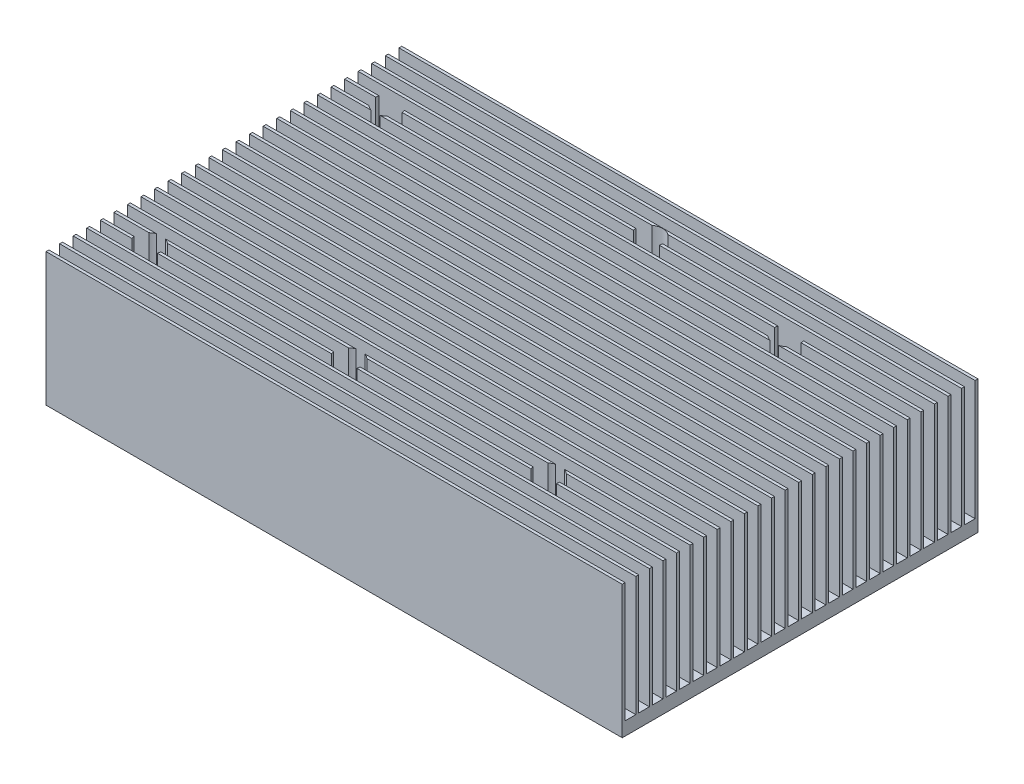
from build123d import *

# Parameters (mm, degrees)
BOSS_EXTRUDE1_DEPTH  = 130
SKETCH2_R            = 3
CUT_EXTRUDE1_DEPTH   = 139.706225167
M3_CLEARANCE_HOLE1_D = 3.4


with BuildPart() as part:
    # Sketch1 → Boss-Extrude1 (new body)
    with BuildSketch(Plane(origin=(0, 0, 0), x_dir=(0, 0, -1), z_dir=(1, 0, 0))):
        Polygon((-40.13, 0), (-40.13, 30), (-39.48, 30), (-39.48, 3), (-37.068076923, 3), (-37.068076923, 30), (-36.418076923, 30), (-36.418076923, 3), (-34.006153846, 3), (-34.006153846, 30), (-33.356153846, 30), (-33.356153846, 3), (-30.944230769, 3), (-30.944230769, 30), (-30.294230769, 30), (-30.294230769, 3), (-27.882307692, 3), (-27.882307692, 30), (-27.232307692, 30), (-27.232307692, 3), (-24.820384615, 3), (-24.820384615, 30), (-24.170384615, 30), (-24.170384615, 3), (-21.758461538, 3), (-21.758461538, 30), (-21.108461538, 30), (-21.108461538, 3), (-18.696538462, 3), (-18.696538462, 30), (-18.046538462, 30), (-18.046538462, 3), (-15.634615385, 3), (-15.634615385, 30), (-14.984615385, 30), (-14.984615385, 3), (-12.572692308, 3), (-12.572692308, 30), (-11.922692308, 30), (-11.922692308, 3), (-9.510769231, 3), (-9.510769231, 30), (-8.860769231, 30), (-8.860769231, 3), (-6.448846154, 3), (-6.448846154, 30), (-5.798846154, 30), (-5.798846154, 3), (-3.386923077, 3), (-3.386923077, 30), (-2.736923077, 30), (-2.736923077, 3), (-0.325, 3), (-0.325, 30), (0.325, 30), (0.325, 3), (2.736923077, 3), (2.736923077, 30), (3.386923077, 30), (3.386923077, 3), (5.798846154, 3), (5.798846154, 30), (6.448846154, 30), (6.448846154, 3), (8.860769231, 3), (8.860769231, 30), (9.510769231, 30), (9.510769231, 3), (11.922692308, 3), (11.922692308, 30), (12.572692308, 30), (12.572692308, 3), (14.984615385, 3), (14.984615385, 30), (15.634615385, 30), (15.634615385, 3), (18.046538462, 3), (18.046538462, 30), (18.696538462, 30), (18.696538462, 3), (21.108461538, 3), (21.108461538, 30), (21.758461538, 30), (21.758461538, 3), (24.170384615, 3), (24.170384615, 30), (24.820384615, 30), (24.820384615, 3), (27.232307692, 3), (27.232307692, 30), (27.882307692, 30), (27.882307692, 3), (30.294230769, 3), (30.294230769, 30), (30.944230769, 30), (30.944230769, 3), (33.356153846, 3), (33.356153846, 30), (34.006153846, 30), (34.006153846, 3), (36.418076923, 3), (36.418076923, 30), (37.068076923, 30), (37.068076923, 3), (39.48, 3), (39.48, 30), (40.13, 30), (40.13, 3), (40.13, 0), align=None)
    extrude(amount=BOSS_EXTRUDE1_DEPTH)

    # Sketch2 → Cut-Extrude1 (cut, through all)
    with BuildSketch(Plane(origin=(0, 3, 0), x_dir=(1, 0, 0), z_dir=(0, 1, 0))):
        with Locations((10, 27)):
            Circle(SKETCH2_R)
        with Locations((100, 27)):
            Circle(SKETCH2_R)
        with Locations((65, 30.944230769)):
            Circle(SKETCH2_R)
        with Locations((10, -27)):
            Circle(SKETCH2_R)
        with Locations((55, -27)):
            Circle(SKETCH2_R)
        with Locations((100, -27)):
            Circle(SKETCH2_R)
    extrude(amount=CUT_EXTRUDE1_DEPTH, mode=Mode.SUBTRACT)

    # M3 Clearance Hole1 (through all)
    with Locations(Plane(origin=(10, 3, -27), x_dir=(0, 0, 1), z_dir=(0, 1, 0))):
        with Locations((0, 0), (-3.944230769, 55), (0, 90), (54, 0), (54, 45), (54, 90)):
            Hole(M3_CLEARANCE_HOLE1_D / 2)


solid = part.part
